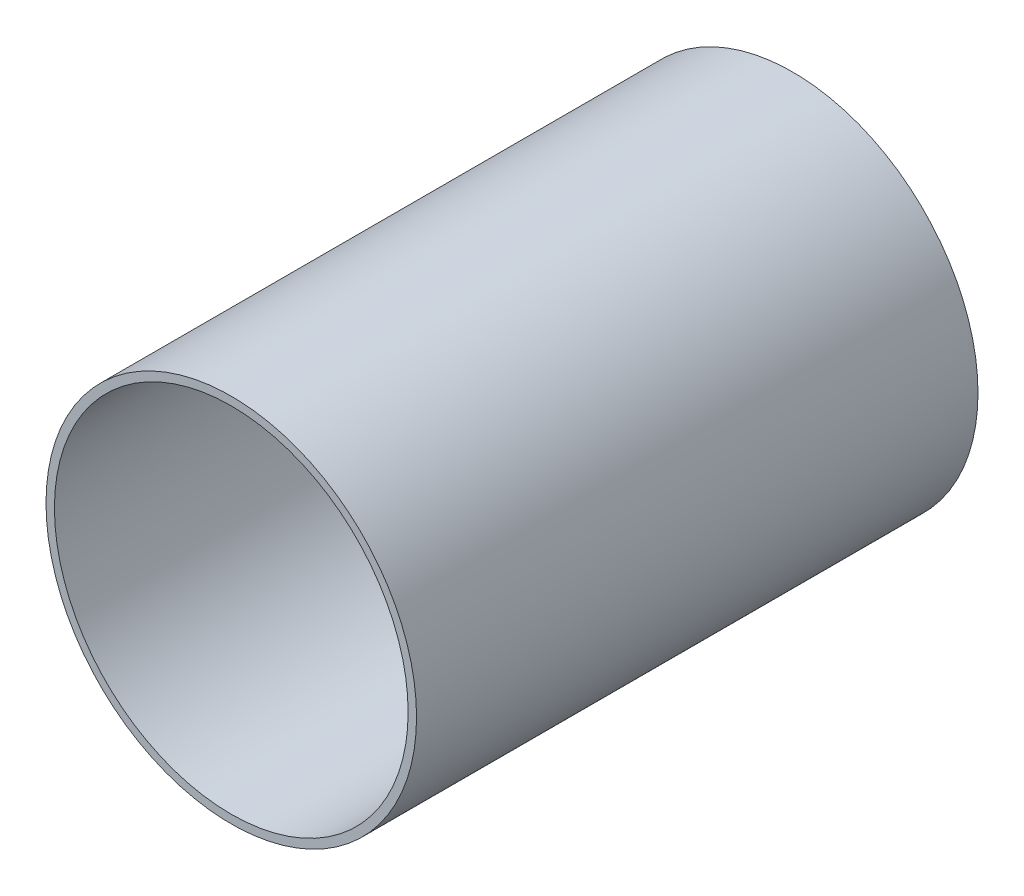
from build123d import *

# Parameters (mm, degrees)
ESQUISSE1_R        = 33
ESQUISSE1_R_2      = 31.5
BOSS_EXTRU_1_DEPTH = 100


with BuildPart() as part:
    # Esquisse1 → Boss.-Extru.1 (new body)
    with BuildSketch(Plane.XY):
        Circle(ESQUISSE1_R)
        Circle(ESQUISSE1_R_2, mode=Mode.SUBTRACT)
    extrude(amount=BOSS_EXTRU_1_DEPTH)


solid = part.part
